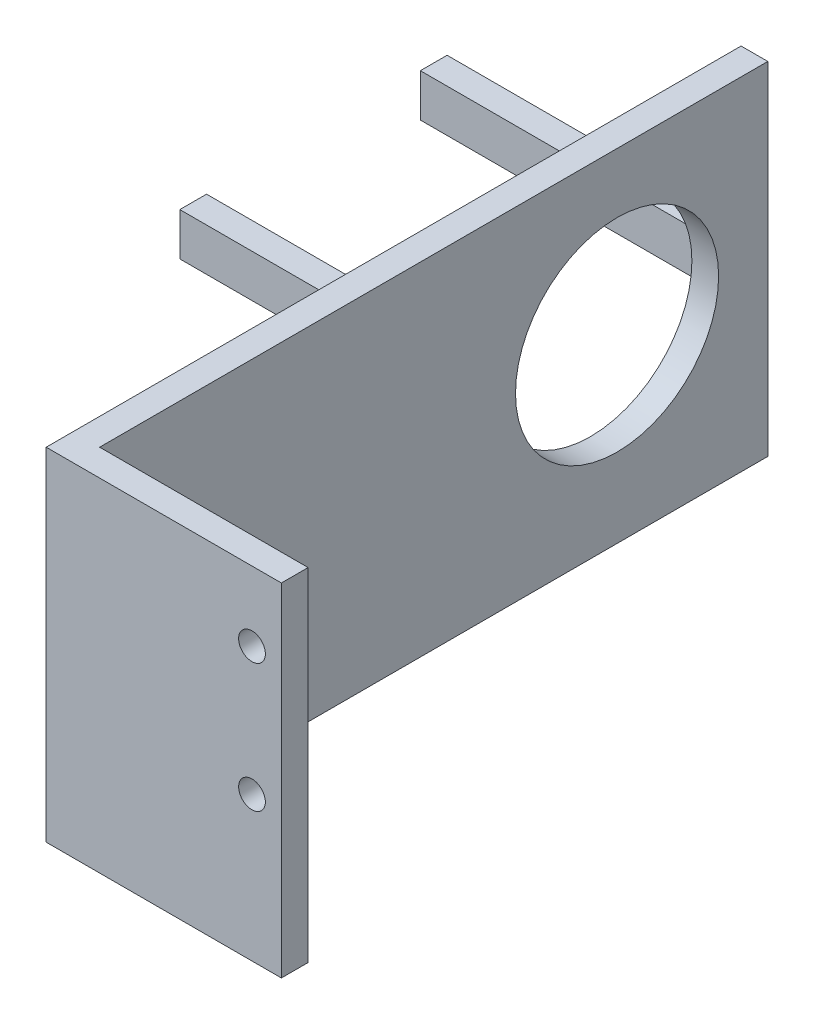
from build123d import *

# Parameters (mm, degrees)
ESQUISSE1_W             = 39
ESQUISSE1_H             = 64
ESQUISSE1_R             = 2.5
BOSS_EXTRU_1_DEPTH      = 5
ESQUISSE2_W             = 5
ESQUISSE2_H             = 64
BOSS_EXTRU_2_DEPTH      = 130
ESQUISSE3_R             = 19
ENL_V_MAT_EXTRU_1_DEPTH = 148.163174742
ESQUISSE4_W             = 5
ESQUISSE4_H             = 8
BOSS_EXTRU_3_DEPTH      = 52


with BuildPart() as part:
    # Esquisse1 → Boss.-Extru.1 (new body)
    with BuildSketch(Plane.XY):
        with Locations((-19.5, 32)):
            Rectangle(ESQUISSE1_W, ESQUISSE1_H)
        with Locations((-5.5, 51)):
            Circle(ESQUISSE1_R, mode=Mode.SUBTRACT)
        with Locations((-5.5, 27)):
            Circle(ESQUISSE1_R, mode=Mode.SUBTRACT)
    extrude(amount=BOSS_EXTRU_1_DEPTH)

    # Esquisse2 → Boss.-Extru.2 (add)
    with BuildSketch(Plane.XY.offset(5)):
        with Locations((-41.5, 32)):
            Rectangle(ESQUISSE2_W, ESQUISSE2_H)
    extrude(amount=-BOSS_EXTRU_2_DEPTH)

    # Esquisse3 → Enlèv. mat.-Extru.1 (cut, through all)
    with BuildSketch(Plane.ZY.offset(44)):
        with Locations(Location((-96.8, 33.8, 0), (0, 0, 270))):
            Circle(ESQUISSE3_R)
    extrude(amount=-ENL_V_MAT_EXTRU_1_DEPTH, mode=Mode.SUBTRACT)

    # Esquisse4 → Boss.-Extru.3 (add)
    with BuildSketch(Plane.ZY.offset(44)):
        with Locations((-74.5, 34)):
            Rectangle(ESQUISSE4_W, ESQUISSE4_H)
        with Locations((-119.5, 34)):
            Rectangle(ESQUISSE4_W, ESQUISSE4_H)
    extrude(amount=BOSS_EXTRU_3_DEPTH)


solid = part.part
